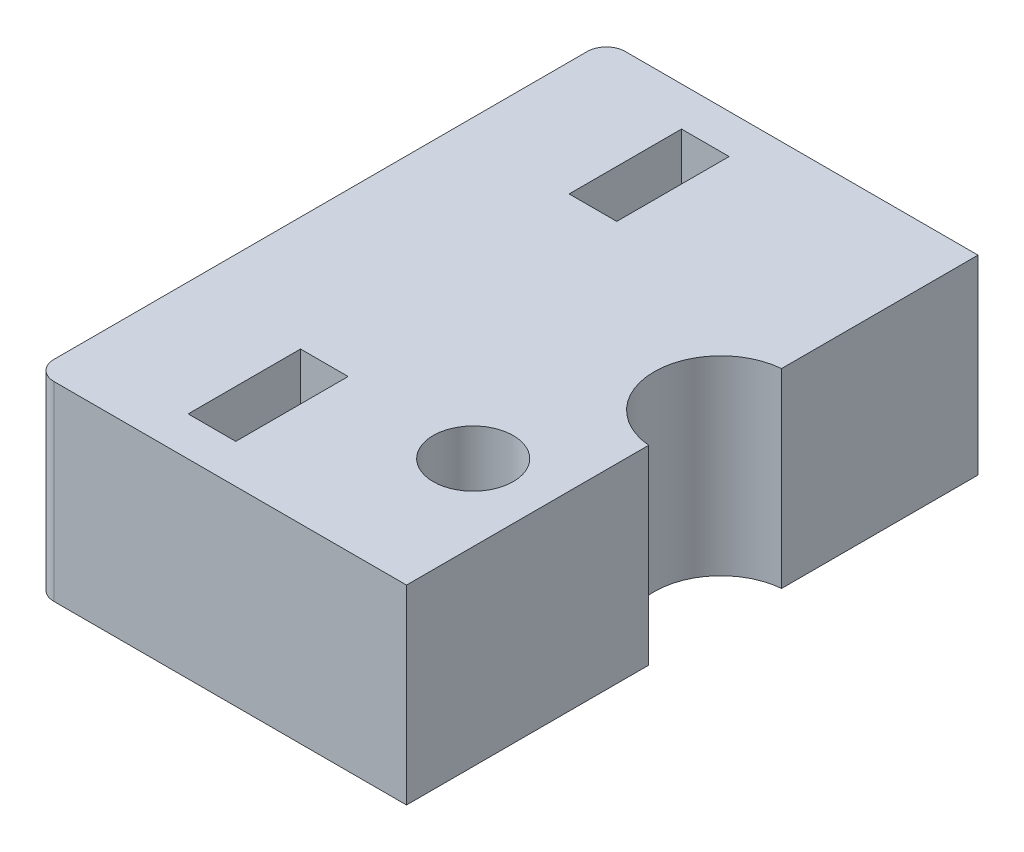
from build123d import *

# Parameters (mm, degrees)
SKETCH1_W           = 59.0272
SKETCH1_H           = 30
BOSS_EXTRUDE1_DEPTH = 10
SKETCH2_R           = 2.1
CUT_EXTRUDE1_DEPTH  = 35.58399319
SKETCH3_R           = 1.65
CUT_EXTRUDE2_DEPTH  = 12
SKETCH4_R           = 1.7
CUT_EXTRUDE3_DEPTH  = 12
CUT_EXTRUDE4_DEPTH  = 2.3
CUT_EXTRUDE5_DEPTH  = 2.5
SKETCH7_R           = 3.5
CUT_EXTRUDE6_DEPTH  = 35.58399319
FILLET1_R           = 1
SKETCH8_W           = 39.5136
SKETCH8_H           = 30
CUT_EXTRUDE7_DEPTH  = 35.58399319


with BuildPart() as part:
    # Sketch1 → Boss-Extrude1 (new body)
    with BuildSketch(Plane(origin=(0, 0, 0), x_dir=(1, 0, 0), z_dir=(0, 1, 0))):
        Rectangle(SKETCH1_W, SKETCH1_H)
    extrude(amount=BOSS_EXTRUDE1_DEPTH)

    # Sketch2 → Cut-Extrude1 (cut, through all)
    with BuildSketch(Plane(origin=(0, 10, 0), x_dir=(1, 0, 0), z_dir=(0, 1, 0))):
        with Locations(Location((-14, -7.5, 0), (0, 0, 270))):
            Circle(SKETCH2_R)
        with Locations(Location((6, -7.5, 0), (0, 0, 270))):
            Circle(SKETCH2_R)
    extrude(amount=-CUT_EXTRUDE1_DEPTH, mode=Mode.SUBTRACT)

    # Sketch3 → Cut-Extrude2 (cut)
    with BuildSketch(Plane(origin=(29.5136, 0, 0), x_dir=(0, 0, -1), z_dir=(1, 0, 0))):
        with Locations((-10, 5)):
            Circle(SKETCH3_R)
        with Locations((10, 5)):
            Circle(SKETCH3_R)
    extrude(amount=-CUT_EXTRUDE2_DEPTH, mode=Mode.SUBTRACT)

    # Sketch4 → Cut-Extrude3 (cut)
    with BuildSketch(Plane.ZY.offset(29.5136)):
        with Locations((-10, 5)):
            Circle(SKETCH4_R)
        with Locations((10, 5)):
            Circle(SKETCH4_R)
    extrude(amount=-CUT_EXTRUDE3_DEPTH, mode=Mode.SUBTRACT)

    # Sketch5 → Cut-Extrude4 (cut)
    with BuildSketch(Plane(origin=(23.5136, 0, 0), x_dir=(0, 0, -1), z_dir=(1, 0, 0))):
        Polygon((-12.85, 6.645448267), (-12.85, 10), (-7.15, 10), (-7.15, 6.645448267), (-7.15, 3.354551733), (-10, 1.709103466), (-12.85, 3.354551733), align=None)
        Polygon((7.15, 6.645448267), (7.15, 3.354551733), (10, 1.709103466), (12.85, 3.354551733), (12.85, 6.645448267), (12.85, 10), (7.15, 10), align=None)
    extrude(amount=-CUT_EXTRUDE4_DEPTH, mode=Mode.SUBTRACT)

    # Sketch6 → Cut-Extrude5 (cut)
    with BuildSketch(Plane.ZY.offset(23.5136)):
        Polygon((-12.95, 6.703183294), (-12.95, 10), (-7.05, 10), (-7.05, 6.703183294), (-7.05, 3.296816706), (-10, 1.593633412), (-12.95, 3.296816706), align=None)
        Polygon((7.05, 6.703183294), (7.05, 3.296816706), (10, 1.593633412), (12.95, 3.296816706), (12.95, 6.703183294), (12.95, 10), (7.05, 10), align=None)
    extrude(amount=-CUT_EXTRUDE5_DEPTH, mode=Mode.SUBTRACT)

    # Sketch7 → Cut-Extrude6 (cut, through all)
    with BuildSketch(Plane(origin=(0, 10, 0), x_dir=(1, 0, 0), z_dir=(0, 1, 0))):
        with Locations(Location((15.7, 1.2, 0), (0, 0, 270))):
            Circle(SKETCH7_R)
        with Locations(Location((-9.7, 1.2, 0), (0, 0, 270))):
            Circle(SKETCH7_R)
    extrude(amount=-CUT_EXTRUDE6_DEPTH, mode=Mode.SUBTRACT)

    # Fillet1
    fillet1_edges = [part.edges().sort_by_distance(p)[0] for p in [
        (29.5136, 5, 15),
        (-29.5136, 5, 15),
        (-29.5136, 5, -15),
        (29.5136, 5, -15),
    ]]
    fillet(fillet1_edges, radius=FILLET1_R)

    # Sketch8 → Cut-Extrude7 (cut, through all)
    with BuildSketch(Plane(origin=(0, 10, 0), x_dir=(1, 0, 0), z_dir=(0, 1, 0))):
        with Locations((9.7568, 0)):
            Rectangle(SKETCH8_W, SKETCH8_H)
    extrude(amount=-CUT_EXTRUDE7_DEPTH, mode=Mode.SUBTRACT)


solid = part.part
